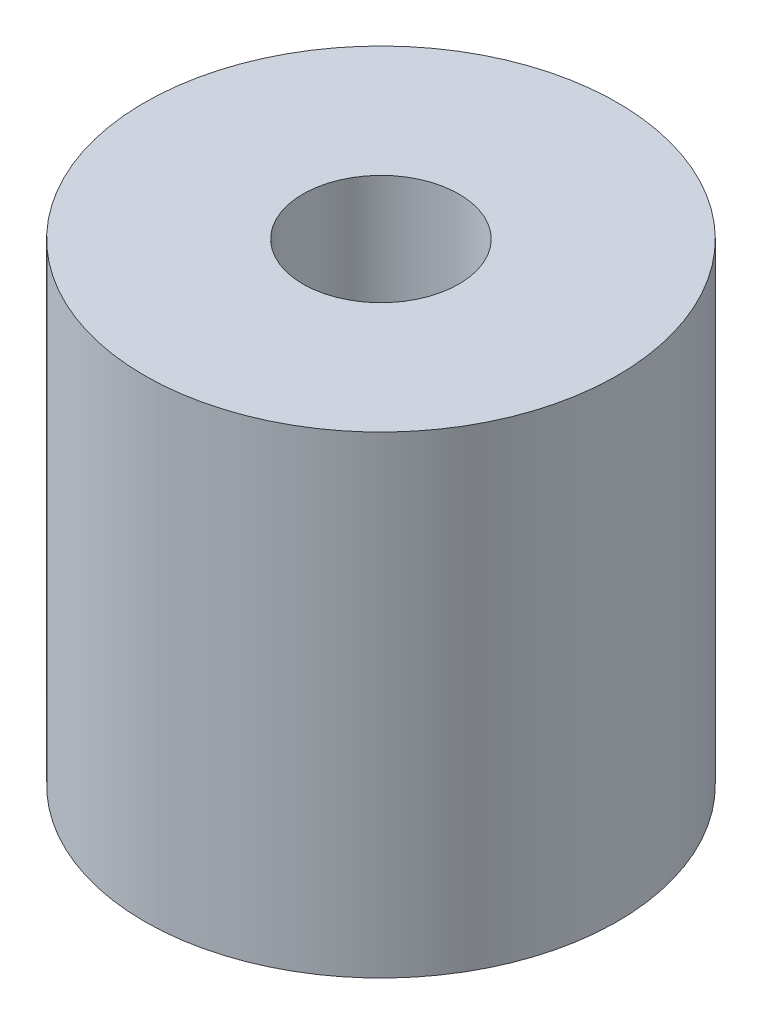
from build123d import *

# Parameters (mm, degrees)
SKETCH1_R           = 6.35
SKETCH1_R_2         = 2.0955
BOSS_EXTRUDE1_DEPTH = 12.7


with BuildPart() as part:
    # Sketch1 → Boss-Extrude1 (new body)
    with BuildSketch(Plane(origin=(0, 0, 0), x_dir=(1, 0, 0), z_dir=(0, 1, 0))):
        with Locations(Location((0, 0, 0), (0, 0, 270))):
            Circle(SKETCH1_R)
        with Locations(Location((0, 0, 0), (0, 0, 270))):
            Circle(SKETCH1_R_2, mode=Mode.SUBTRACT)
    extrude(amount=BOSS_EXTRUDE1_DEPTH)


solid = part.part
